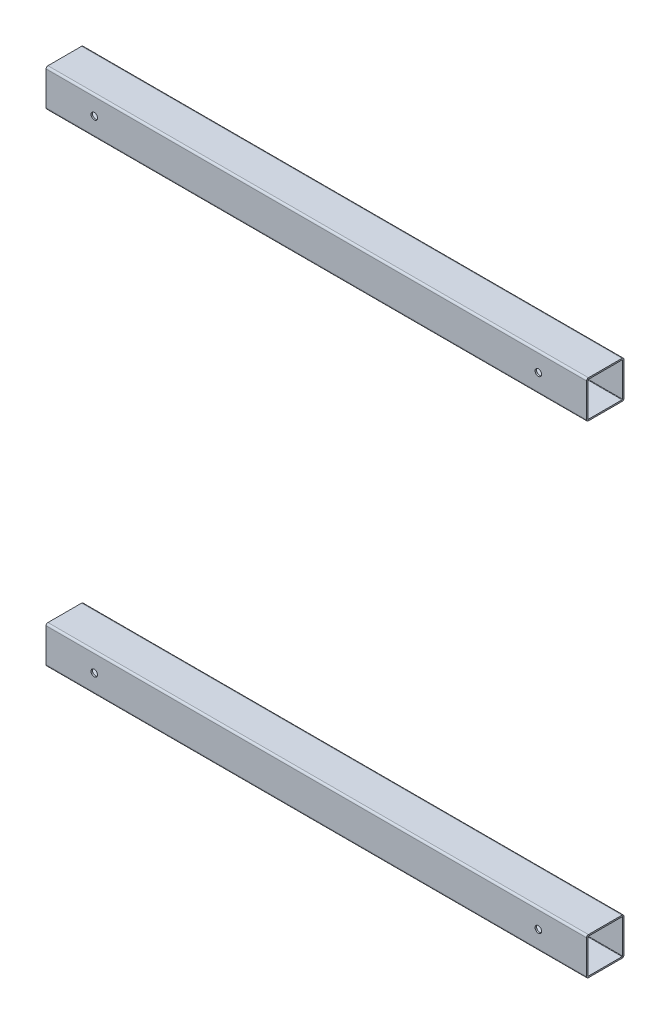
from build123d import *

# Parameters (mm, degrees)
C_USERS_RAULSTAR_MEU_DRIVE_TEMPLATES_BIB_DEPTH = 578.0536
C_USERS_RAULSTAR_MEU_DRIVE_TEMPLATES_2_DEPTH   = 578.0536
CORTE_EXTRUS_O1_DEPTH                          = 611.07295194
CORTE_EXTRUS_O1_DEPTH_BACK                     = 611.07295194
ESBO_O4_R                                      = 3.5


with BuildPart() as part:
    # Esboço1 → C_USERS_RAULSTAR_MEU DRIVE_TEMPLATES_BIB (new body)
    with BuildSketch(Plane.YZ.offset(-289.0268)):
        with BuildLine():
            Line((-18, -20), (18, -20))
            ThreePointArc((18, -20), (19.414213562, -19.414213562), (20, -18))
            Line((20, -18), (20, 18))
            ThreePointArc((20, 18), (19.414213562, 19.414213562), (18, 20))
            Line((18, 20), (-18, 20))
            ThreePointArc((-18, 20), (-19.414213562, 19.414213562), (-20, 18))
            Line((-20, 18), (-20, -18))
            ThreePointArc((-20, -18), (-19.414213562, -19.414213562), (-18, -20))
        make_face()
        with BuildLine():
            Line((-18, -18.45), (18, -18.45))
            ThreePointArc((18, -18.45), (18.318198052, -18.318198052), (18.45, -18))
            Line((18.45, -18), (18.45, 18))
            ThreePointArc((18.45, 18), (18.318198052, 18.318198052), (18, 18.45))
            Line((18, 18.45), (-18, 18.45))
            ThreePointArc((-18, 18.45), (-18.318198052, 18.318198052), (-18.45, 18))
            Line((-18.45, 18), (-18.45, -18))
            ThreePointArc((-18.45, -18), (-18.318198052, -18.318198052), (-18, -18.45))
        make_face(mode=Mode.SUBTRACT)
    extrude(amount=C_USERS_RAULSTAR_MEU_DRIVE_TEMPLATES_BIB_DEPTH)


with BuildPart() as body_2:
    # Esboço1 on segment 2 (carried to segment 2) → C_USERS_RAULSTAR_MEU DRIVE_TEMPLATES 2 (new body)
    with BuildSketch(Plane(origin=(-289.0268, -515.772820858, 0), x_dir=(0, 1, 0), z_dir=(1, 0, 0))):
        with BuildLine():
            Line((-18, -20), (18, -20))
            ThreePointArc((18, -20), (19.414213562, -19.414213562), (20, -18))
            Line((20, -18), (20, 18))
            ThreePointArc((20, 18), (19.414213562, 19.414213562), (18, 20))
            Line((18, 20), (-18, 20))
            ThreePointArc((-18, 20), (-19.414213562, 19.414213562), (-20, 18))
            Line((-20, 18), (-20, -18))
            ThreePointArc((-20, -18), (-19.414213562, -19.414213562), (-18, -20))
        make_face()
        with BuildLine():
            Line((-18, -18.45), (18, -18.45))
            ThreePointArc((18, -18.45), (18.318198052, -18.318198052), (18.45, -18))
            Line((18.45, -18), (18.45, 18))
            ThreePointArc((18.45, 18), (18.318198052, 18.318198052), (18, 18.45))
            Line((18, 18.45), (-18, 18.45))
            ThreePointArc((-18, 18.45), (-18.318198052, 18.318198052), (-18.45, 18))
            Line((-18.45, 18), (-18.45, -18))
            ThreePointArc((-18.45, -18), (-18.318198052, -18.318198052), (-18, -18.45))
        make_face(mode=Mode.SUBTRACT)
    extrude(amount=C_USERS_RAULSTAR_MEU_DRIVE_TEMPLATES_2_DEPTH)


with BuildPart() as corte_extrus_o1_tool:
    # Esboço4 → Corte-extrusão1 (new, two sides: drawn at the far end of the back side and taken through both)
    with BuildSketch(Plane(origin=(0, 0, -20), x_dir=(-1, 0, 0), z_dir=(0, 0, -1)).offset(-CORTE_EXTRUS_O1_DEPTH_BACK)):
        with Locations(Location((-237.5, 0, 0), (0, 0, 270))):
            Circle(ESBO_O4_R)
        with Locations(Location((237.5, 0, 0), (0, 0, 270))):
            Circle(ESBO_O4_R)
        with Locations(Location((-237.5, -515.772820858, 0), (0, 0, 270))):
            Circle(ESBO_O4_R)
        with Locations(Location((237.5, -515.772820858, 0), (0, 0, 270))):
            Circle(ESBO_O4_R)
    extrude(amount=CORTE_EXTRUS_O1_DEPTH + CORTE_EXTRUS_O1_DEPTH_BACK)


with BuildPart() as part_1:
    add(part.part)

    # Corte-extrusão1: cut by corte_extrus_o1_tool
    add(corte_extrus_o1_tool.part, mode=Mode.SUBTRACT)


with BuildPart() as body_2_1:
    add(body_2.part)

    # Corte-extrusão1: cut by corte_extrus_o1_tool
    add(corte_extrus_o1_tool.part, mode=Mode.SUBTRACT)


solid = Compound([part_1.part, body_2_1.part])
